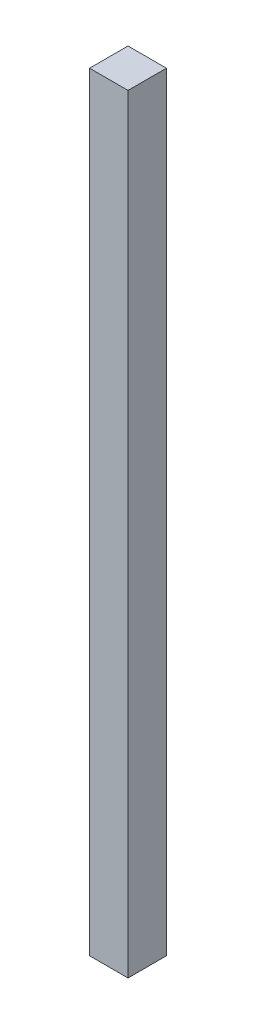
from build123d import *

# Parameters (mm, degrees)
SKETCH1_W           = 5
SKETCH1_H           = 5
BOSS_EXTRUDE1_DEPTH = 100


with BuildPart() as part:
    # Sketch1 → Boss-Extrude1 (new body)
    with BuildSketch(Plane(origin=(0, 0, 0), x_dir=(1, 0, 0), z_dir=(0, 1, 0))):
        with Locations((2.5, 2.5)):
            Rectangle(SKETCH1_W, SKETCH1_H)
    extrude(amount=BOSS_EXTRUDE1_DEPTH)


solid = part.part
